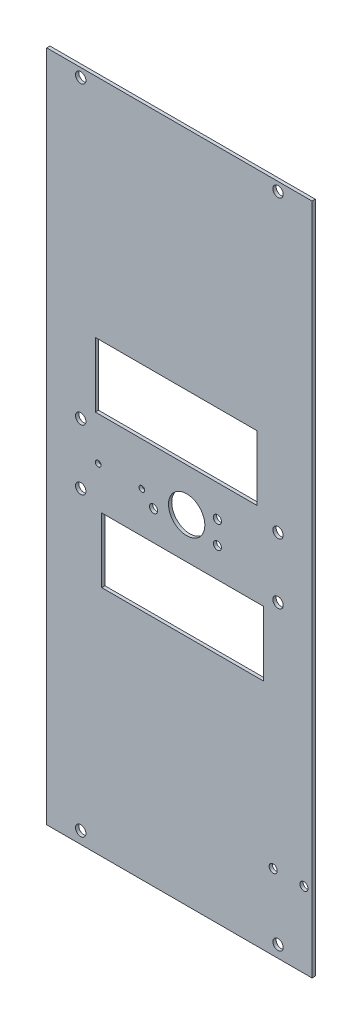
from build123d import *

# Parameters (mm, degrees)
SKETCH1_W                      = 82
SKETCH1_H                      = 208
BOSS_EXTRUDE1_DEPTH            = 1
F_3_2_3_2_DIAMETER_HOLE1_D     = 3.2
F_3_2_3_2_DIAMETER_HOLE1_DEPTH = 1
SKETCH7_W                      = 50
SKETCH7_H                      = 20
CUT_EXTRUDE2_DEPTH             = 10
F_2_5_2_5_DIAMETER_HOLE1_D     = 2.5
F_1_75_1_75_DIAMETER_HOLE1_D   = 1.75
SKETCH12_R                     = 1.25
CUT_EXTRUDE3_DEPTH             = 10
SKETCH13_R                     = 5.614838764
CUT_EXTRUDE4_DEPTH             = 10


with BuildPart() as part:
    # Sketch1 → Boss-Extrude1 (new body)
    with BuildSketch(Plane.XY):
        Rectangle(SKETCH1_W, SKETCH1_H)
    extrude(amount=BOSS_EXTRUDE1_DEPTH)

    # Ø3.2 (3.2) Diameter Hole1
    with Locations(Plane.XY.offset(1)):
        with Locations((-30.5, 10), (30.5, 10), (30.49999746, -100.29999968), (-30.50000246, -100.29999968), (-30.5, 101.3), (30.5, 101.3), (30.49999746, -8.7), (30.644996947, -118.559802529), (-30.50000246, -8.7)):
            Hole(F_3_2_3_2_DIAMETER_HOLE1_D / 2, depth=F_3_2_3_2_DIAMETER_HOLE1_DEPTH)

    # Sketch7 → Cut-Extrude2 (cut)
    with BuildSketch(Plane(origin=(0, 0, 0), x_dir=(-1, 0, 0), z_dir=(0, 0, -1))):
        with Locations((-1, -22)):
            Rectangle(SKETCH7_W, SKETCH7_H)
        with Locations((1, 24)):
            Rectangle(SKETCH7_W, SKETCH7_H)
    extrude(amount=-CUT_EXTRUDE2_DEPTH, mode=Mode.SUBTRACT)

    # Ø2.5 (2.5) Diameter Hole1 (through all)
    with Locations(Plane(origin=(0, 0, 0), x_dir=(-1, 0, 0), z_dir=(0, 0, -1))):
        with Locations((-29, -80.702796173), (-38.5, -80.702796173)):
            Hole(F_2_5_2_5_DIAMETER_HOLE1_D / 2)

    # Ø1.75 (1.75) Diameter Hole1 (through all)
    with Locations(Plane.XY.offset(1)):
        with Locations((-25.1, 0.65), (-11.6, 0.65)):
            Hole(F_1_75_1_75_DIAMETER_HOLE1_D / 2)

    # Sketch12 → Cut-Extrude3 (cut)
    with BuildSketch(Plane.XY.offset(1)):
        with Locations((-8, -2.84999878)):
            Circle(SKETCH12_R)
        with Locations((11.75, -2.84999878)):
            Circle(SKETCH12_R)
        with Locations((11.75, 4.15000122)):
            Circle(SKETCH12_R)
    extrude(amount=-CUT_EXTRUDE3_DEPTH, mode=Mode.SUBTRACT)

    # Sketch13 → Cut-Extrude4 (cut)
    with BuildSketch(Plane(origin=(0, 0, 0), x_dir=(-1, 0, 0), z_dir=(0, 0, -1))):
        with Locations((-2.25, 0.65000122)):
            Circle(SKETCH13_R)
    extrude(amount=-CUT_EXTRUDE4_DEPTH, mode=Mode.SUBTRACT)


solid = part.part
